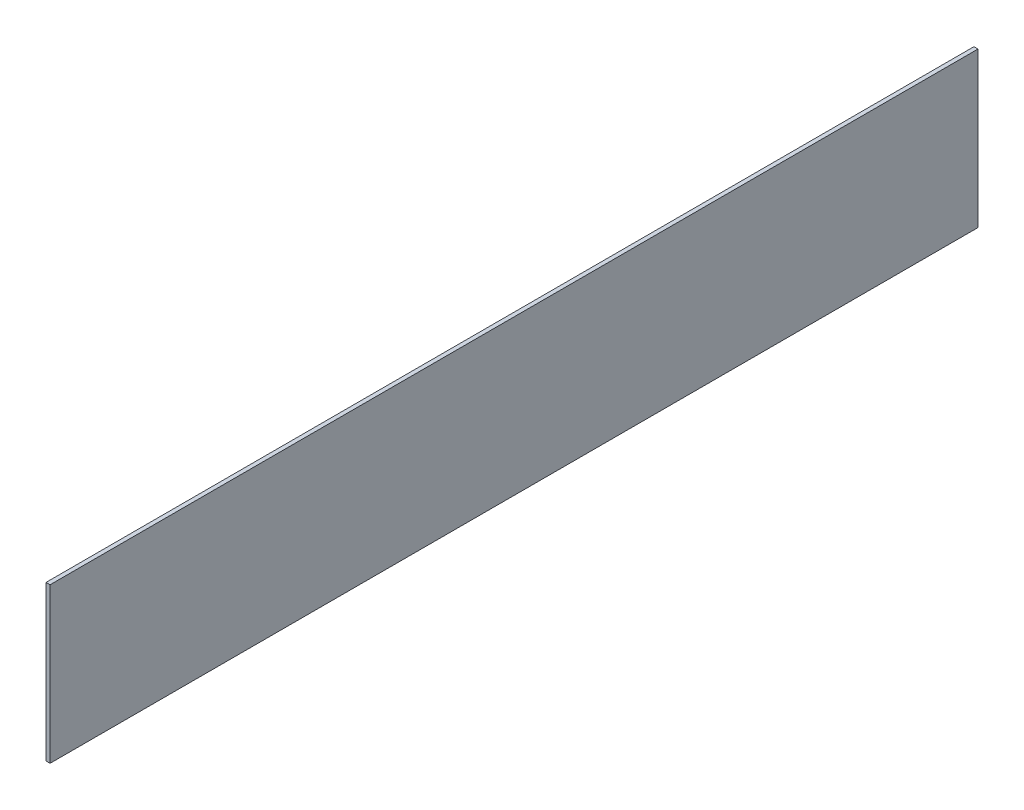
from build123d import *

# Parameters (mm, degrees)
SKETCH1_W           = 457.2
SKETCH1_H           = 76.2
BOSS_EXTRUDE1_DEPTH = 2.000000064


with BuildPart() as part:
    # Sketch1 → Boss-Extrude1 (new body)
    with BuildSketch(Plane(origin=(0, 0, 0), x_dir=(0, 0, -1), z_dir=(1, 0, 0))):
        Rectangle(SKETCH1_W, SKETCH1_H)
    extrude(amount=BOSS_EXTRUDE1_DEPTH)


solid = part.part
